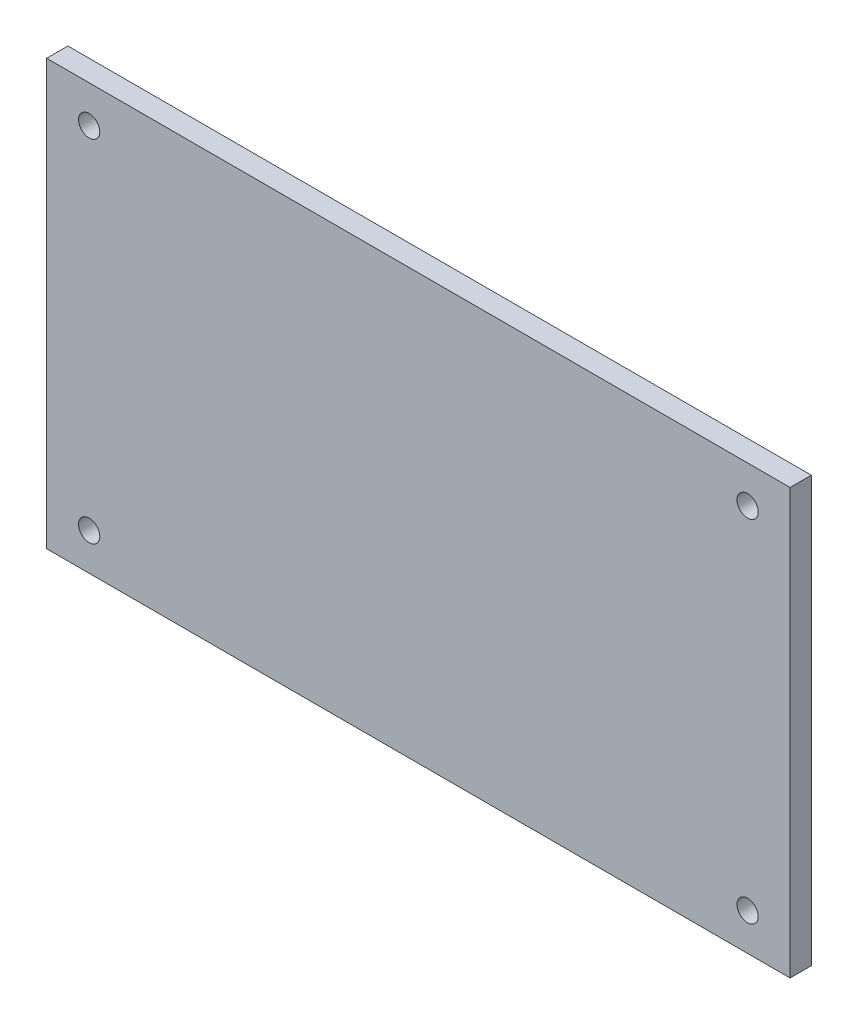
from build123d import *

# Parameters (mm, degrees)
SKETCH1_W           = 105
SKETCH1_H           = 60
BOSS_EXTRUDE1_DEPTH = 3
SKETCH2_R           = 1.5
CUT_EXTRUDE1_DEPTH  = 61.541308212


with BuildPart() as part:
    # Sketch1 → Boss-Extrude1 (new body)
    with BuildSketch(Plane.XY):
        Rectangle(SKETCH1_W, SKETCH1_H)
    extrude(amount=BOSS_EXTRUDE1_DEPTH)

    # Sketch2 → Cut-Extrude1 (cut, through all)
    with BuildSketch(Plane(origin=(0, 0, 0), x_dir=(-1, 0, 0), z_dir=(0, 0, -1))):
        with Locations((-46.5, 24.75)):
            Circle(SKETCH2_R)
        with Locations((-46.5, -24.75)):
            Circle(SKETCH2_R)
        with Locations((46.5, -24.75)):
            Circle(SKETCH2_R)
        with Locations((46.5, 24.75)):
            Circle(SKETCH2_R)
    extrude(amount=-CUT_EXTRUDE1_DEPTH, mode=Mode.SUBTRACT)


solid = part.part
